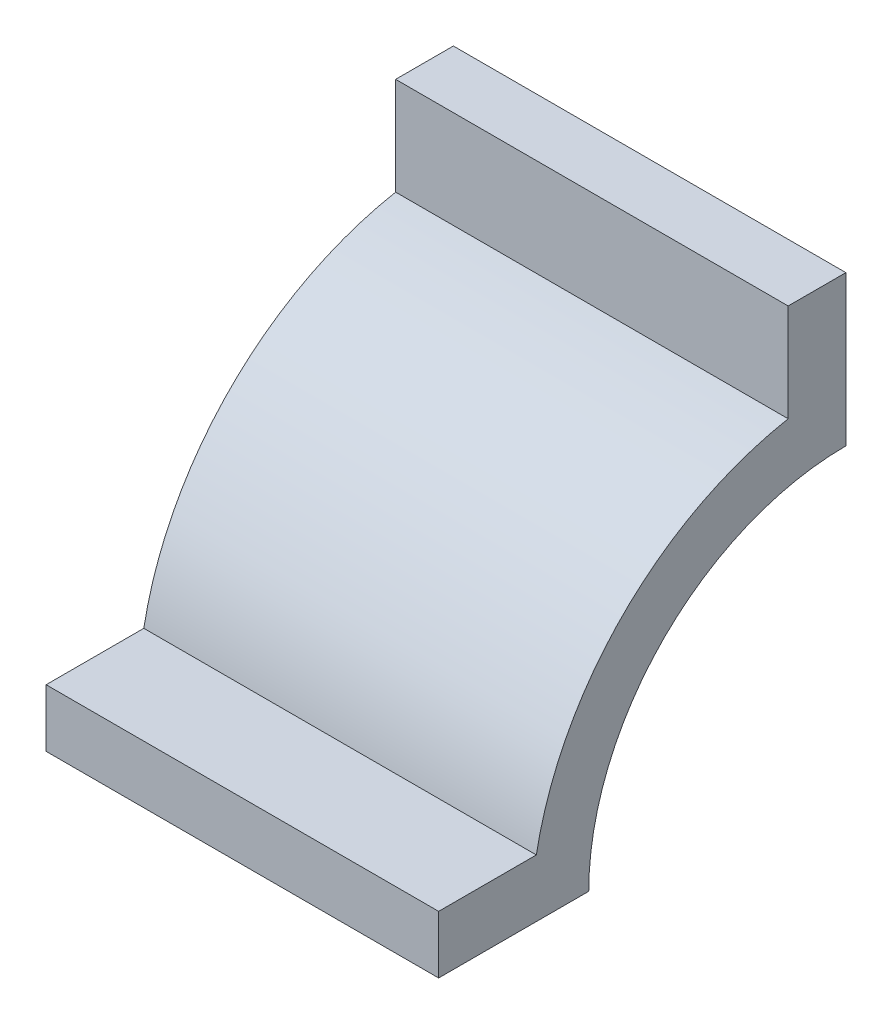
from build123d import *

# Parameters (mm, degrees)
BOSS_EXTRUDE1_DEPTH = 34


with BuildPart() as part:
    # Sketch1 → Boss-Extrude1 (new body)
    with BuildSketch(Plane(origin=(0, 0, 0), x_dir=(0, 0, -1), z_dir=(1, 0, 0))):
        with BuildLine():
            Line((-35.275, 0), (-22.275, 0))
            ThreePointArc((-22.275, 0), (-15.750803551, 15.750803551), (0, 22.275))
            Line((0, 22.275), (0, 35.275))
            Line((0, 35.275), (-5, 35.275))
            Line((-5, 35.275), (-5, 26.81278846))
            ThreePointArc((-5, 26.81278846), (-19.286337457, 19.286337457), (-26.81278846, 5))
            Line((-26.81278846, 5), (-35.275, 5))
            Line((-35.275, 5), (-35.275, 0))
        make_face()
    extrude(amount=BOSS_EXTRUDE1_DEPTH)


solid = part.part
